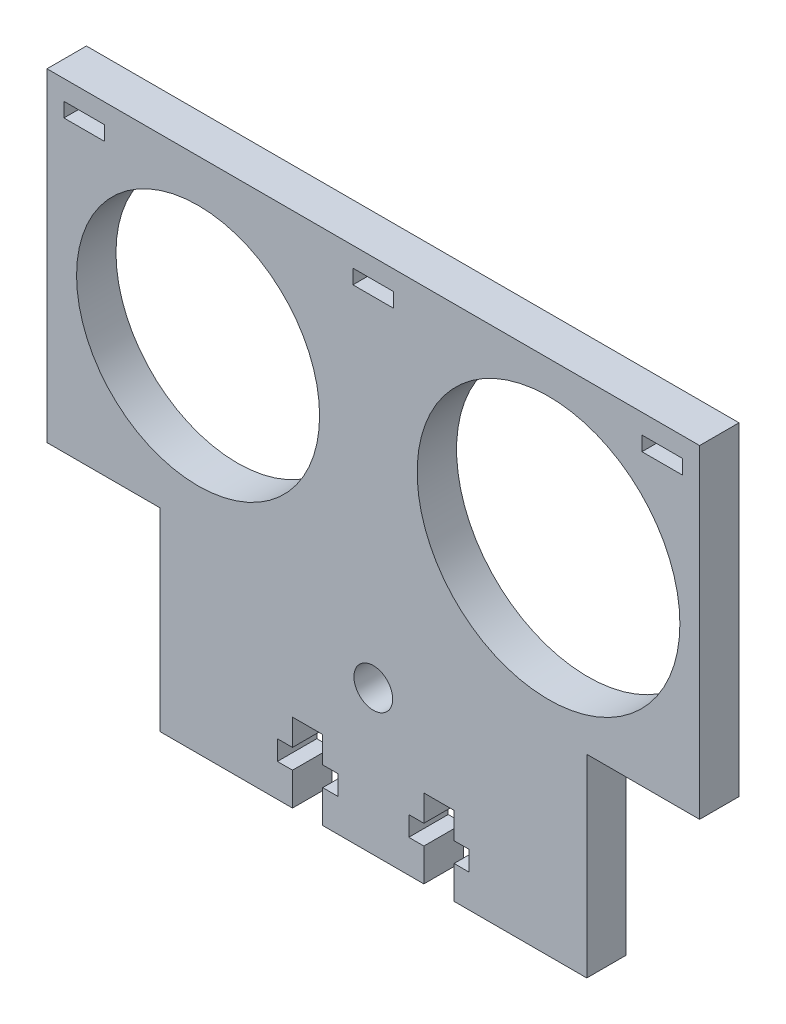
from build123d import *

# Parameters (mm, degrees)
SKETCH1_R           = 2.95
SKETCH1_R_2         = 20
SKETCH1_R_3         = 18.5
BOSS_EXTRUDE1_DEPTH = 6
CUT_EXTRUDE2_DEPTH  = 76.689323992
SKETCH4_W           = 6.2
SKETCH4_H           = 2.2
CUT_EXTRUDE3_DEPTH  = 76.689323992


with BuildPart() as part:
    # Sketch1 → Boss-Extrude1 (new body)
    with BuildSketch(Plane.XY):
        Polygon((-32.5, 7.5), (-32.5, -22), (32.5, -22), (32.5, 7.5), (49.675685802, 7.5), (49.675685802, 56.790844389), (-49.675685802, 56.790844389), (-49.675685802, 7.5), align=None)
        Circle(SKETCH1_R, mode=Mode.SUBTRACT)
        with Locations((26.675685802, 31.790844389)):
            Circle(SKETCH1_R_2, mode=Mode.SUBTRACT)
        with Locations((-26.675685802, 31.790844389)):
            Circle(SKETCH1_R_3, mode=Mode.SUBTRACT)
    extrude(amount=BOSS_EXTRUDE1_DEPTH)

    # Sketch3 → Cut-Extrude2 (cut, through all)
    with BuildSketch(Plane.XY.offset(6)):
        Polygon((-12.3, -22), (-7.7, -22), (-7.7, -17), (-5.4, -17), (-5.4, -14), (-7.7, -14), (-7.7, -10), (-12.3, -10), (-12.3, -14), (-14.6, -14), (-14.6, -17), (-12.3, -17), align=None)
        Polygon((7.7, -14), (7.7, -10), (12.3, -10), (12.3, -14), (14.6, -14), (14.6, -17), (12.3, -17), (12.3, -22), (7.7, -22), (7.7, -17), (5.4, -17), (5.4, -14), align=None)
    extrude(amount=-CUT_EXTRUDE2_DEPTH, mode=Mode.SUBTRACT)

    # Sketch4 → Cut-Extrude3 (cut, through all)
    with BuildSketch(Plane.XY.offset(6)):
        with Locations((0, 52.690844389)):
            Rectangle(SKETCH4_W, SKETCH4_H)
        with Locations((44, 52.690844389)):
            Rectangle(SKETCH4_W, SKETCH4_H)
        with Locations((-44, 52.690844389)):
            Rectangle(SKETCH4_W, SKETCH4_H)
    extrude(amount=-CUT_EXTRUDE3_DEPTH, mode=Mode.SUBTRACT)


solid = part.part
